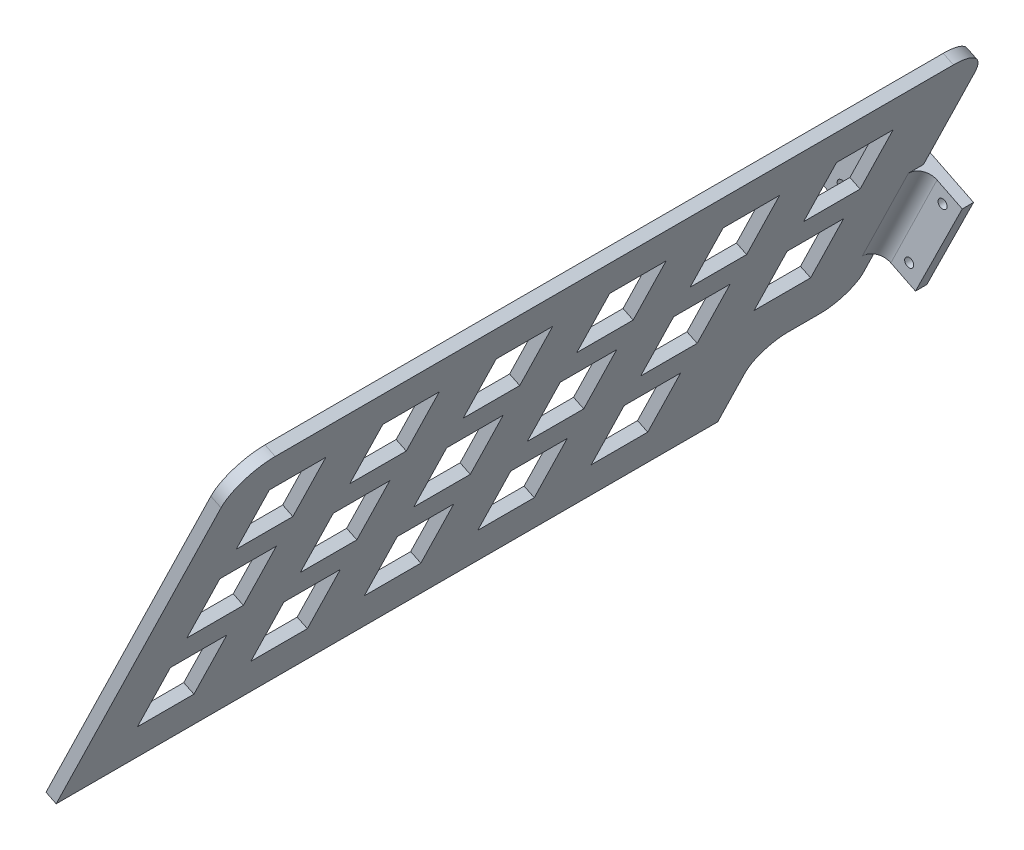
from build123d import *

# Parameters (mm, degrees)
SKETCH_1_R          = 1.2
EXTRUDE_1_DEPTH     = 3
EXTRUDE_2_DEPTH     = 200
FILLET_1_R          = 4
SKETCH_4_W          = 24.434656606
SKETCH_4_H          = 24.505426632
CUT_EXTRUDE_1_DEPTH = 4
FILLET_3_R          = 8
SKETCH_5_W          = 15
SKETCH_5_H          = 20
CUT_EXTRUDE_2_DEPTH = 10
FILLET_4_R          = 10
FILLET_5_R          = 10


with BuildPart() as part:
    # 草图1 → 凸台-拉伸1 (new body)
    with BuildSketch(Plane.XY):
        Polygon((-68.534318099, 4.283164377), (-80.94435421, -20.816457208), (-55.844732625, -33.22649332), (-43.434696514, -8.126871734), align=None)
        with Locations((-66.577549394, -0.711768645)):
            Circle(SKETCH_1_R, mode=Mode.SUBTRACT)
        with Locations((-75.441860902, -18.640069777)):
            Circle(SKETCH_1_R, mode=Mode.SUBTRACT)
        with Locations((-57.51355977, -27.504381286)):
            Circle(SKETCH_1_R, mode=Mode.SUBTRACT)
        with Locations((-48.649248262, -9.576080153)):
            Circle(SKETCH_1_R, mode=Mode.SUBTRACT)
    extrude(amount=EXTRUDE_1_DEPTH)

    # 草图2 → 凸台-拉伸2 (add)
    with BuildSketch(Plane.XY.offset(3)):
        Polygon((-86.606649797, -63.783530386), (-38.474241258, 35.126889936), (-35.77668434, 33.814187885), (-83.909092879, -65.096232437), align=None)
    extrude(amount=EXTRUDE_2_DEPTH)

    # 圆角1
    fillet_1_edges = [part.edges().sort_by_distance(p)[0] for p in [
        (-59.839316246, -15.633681193, 3),
        (-62.528614635, -14.304008154, 3),
    ]]
    fillet(fillet_1_edges, radius=FILLET_1_R)

    # 草图4 → 切除-拉伸1 (cut)
    with BuildSketch(Plane(origin=(-44.928588602, 21.863431321, 0), x_dir=(0, 0, 1), z_dir=(-0.8991856392880848, 0.43756735035658034, 0))):
        with Locations((15.217328303, -82.996763505)):
            Rectangle(SKETCH_4_W, SKETCH_4_H)
    extrude(amount=-CUT_EXTRUDE_1_DEPTH, mode=Mode.SUBTRACT)

    # 圆角3
    fillet_3_edges = [part.edges().sort_by_distance(p)[0] for p in [
        (-74.535096738, -42.4049537, 3),
        (-74.535096738, -42.4049537, 27.434656606),
    ]]
    fillet(fillet_3_edges, radius=FILLET_3_R)

    # 草图5 → 切除-拉伸2 (cut)
    with BuildSketch(Plane(origin=(-42.231031684, 20.55072927, 0), x_dir=(0, 0, -1), z_dir=(0.8991856392880848, -0.4375673503565804, 0))):
        with Locations((-60.064574797, -10.249476821)):
            Rectangle(SKETCH_5_W, SKETCH_5_H)
        with Locations((-29.955718497, -10.249476821)):
            Rectangle(SKETCH_5_W, SKETCH_5_H)
        with Locations((-90.173431098, -10.249476821)):
            Rectangle(SKETCH_5_W, SKETCH_5_H)
        with Locations((-120.282287399, -10.249476821)):
            Rectangle(SKETCH_5_W, SKETCH_5_H)
        with Locations((-150.391143699, -10.249476821)):
            Rectangle(SKETCH_5_W, SKETCH_5_H)
        with Locations((-180.5, -10.249476821)):
            Rectangle(SKETCH_5_W, SKETCH_5_H)
        with Locations((-60.064574797, -40.249476821)):
            Rectangle(SKETCH_5_W, SKETCH_5_H)
        with Locations((-90.173431098, -40.249476821)):
            Rectangle(SKETCH_5_W, SKETCH_5_H)
        with Locations((-120.282287399, -40.249476821)):
            Rectangle(SKETCH_5_W, SKETCH_5_H)
        with Locations((-150.391143699, -40.249476821)):
            Rectangle(SKETCH_5_W, SKETCH_5_H)
        with Locations((-180.5, -40.249476821)):
            Rectangle(SKETCH_5_W, SKETCH_5_H)
        with Locations((-60.064574797, -70.249476821)):
            Rectangle(SKETCH_5_W, SKETCH_5_H)
        with Locations((-90.173431098, -70.249476821)):
            Rectangle(SKETCH_5_W, SKETCH_5_H)
        with Locations((-120.282287399, -70.249476821)):
            Rectangle(SKETCH_5_W, SKETCH_5_H)
        with Locations((-150.391143699, -70.249476821)):
            Rectangle(SKETCH_5_W, SKETCH_5_H)
        with Locations((-180.5, -70.249476821)):
            Rectangle(SKETCH_5_W, SKETCH_5_H)
        with Locations((-29.955718497, -40.249476821)):
            Rectangle(SKETCH_5_W, SKETCH_5_H)
    extrude(amount=-CUT_EXTRUDE_2_DEPTH, mode=Mode.SUBTRACT)

    # 圆角4
    fillet_4_edges = [part.edges().sort_by_distance(p)[0] for p in [
        (-37.125462799, 34.470538911, 203),
    ]]
    fillet(fillet_4_edges, radius=FILLET_4_R)

    # 圆角5
    fillet_5_edges = [part.edges().sort_by_distance(p)[0] for p in [
        (-37.125462799, 34.470538911, 3),
    ]]
    fillet(fillet_5_edges, radius=FILLET_5_R)


solid = part.part
